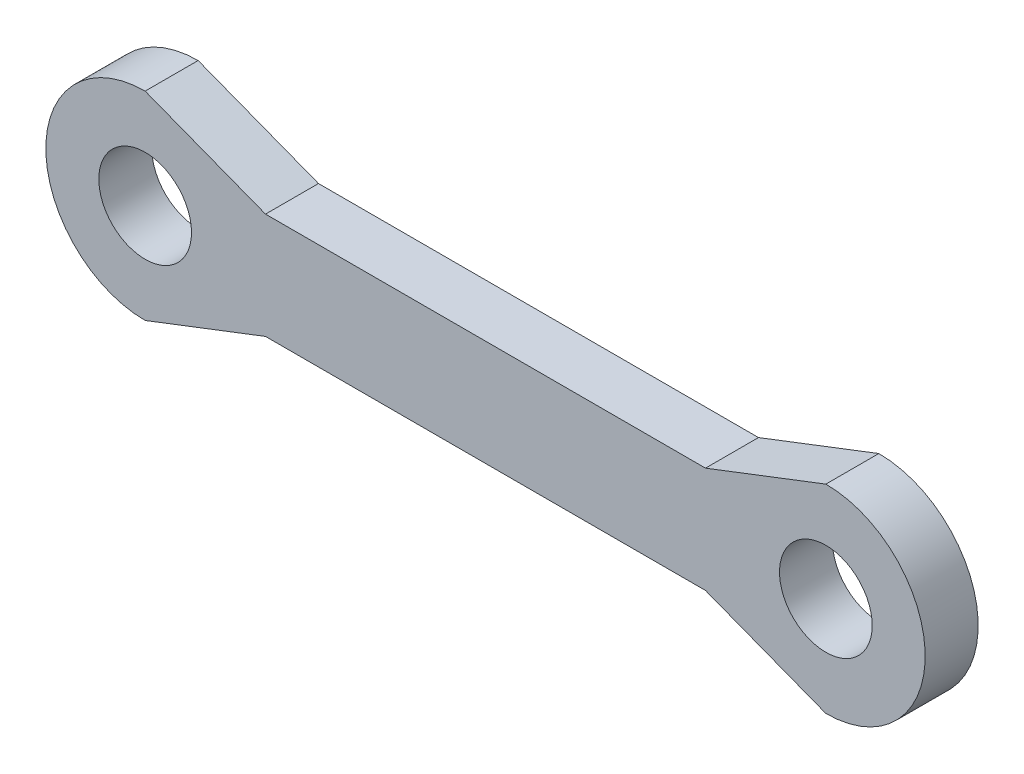
from build123d import *

# Parameters (mm, degrees)
SKETCH1_R           = 3.5
BOSS_EXTRUDE2_DEPTH = 4


with BuildPart() as part:
    # Sketch1 → Boss-Extrude2 (new body)
    with BuildSketch(Plane.XY):
        with BuildLine():
            Line((0, 7.5), (-9.088423691, 4))
            Line((-9.088423691, 4), (-42.311576309, 4))
            Line((-42.311576309, 4), (-51.4, 7.5))
            ThreePointArc((-51.4, 7.5), (-58.9, 0), (-51.4, -7.5))
            Line((-51.4, -7.5), (-42.311576309, -4))
            Line((-42.311576309, -4), (-9.088423691, -4))
            Line((-9.088423691, -4), (0, -7.5))
            ThreePointArc((0, -7.5), (7.5, 0), (0, 7.5))
        make_face()
        Circle(SKETCH1_R, mode=Mode.SUBTRACT)
        with Locations((-51.4, 0)):
            Circle(SKETCH1_R, mode=Mode.SUBTRACT)
    extrude(amount=BOSS_EXTRUDE2_DEPTH)


solid = part.part
